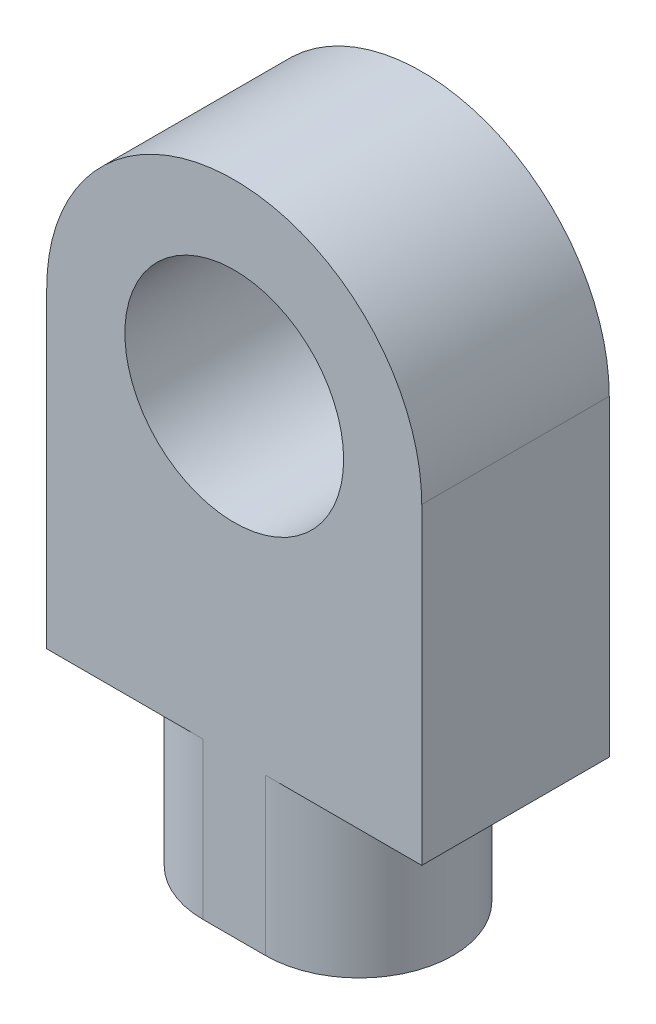
from build123d import *

# Parameters (mm, degrees)
BOSS_EXTRUDE1_DEPTH       = 6
M8X1_0_TAPPED_HOLE1_D     = 7
M8X1_0_TAPPED_HOLE1_DEPTH = 19
M8X1_0_TAPPED_HOLE1_TIP   = 2.103012167
CUT_EXTRUDE1_DEPTH        = 23.649503306
CUT_EXTRUDE1_DEPTH_BACK   = 5
SKETCH4_W                 = 9.430442817
SKETCH4_H                 = 6.865018404


with BuildPart() as part:
    # Sketch1 → Boss-Extrude1 (new body)
    with BuildSketch(Plane.XY):
        with BuildLine():
            Line((-4, -5), (4, -5))
            Line((4, -5), (4, 0))
            Line((4, 0), (6, 0))
            Line((6, 0), (6, 10))
            ThreePointArc((6, 10), (0, 16), (-6, 10))
            Line((-6, 10), (-6, 0))
            Line((-6, 0), (-4, 0))
            Line((-4, 0), (-4, -5))
        make_face()
    extrude(amount=BOSS_EXTRUDE1_DEPTH)

    # M8x1.0 Tapped Hole1
    with Locations(Plane.XY.offset(6)):
        with Locations((0, 10)):
            Hole(M8X1_0_TAPPED_HOLE1_D / 2, depth=M8X1_0_TAPPED_HOLE1_DEPTH)
            with Locations((0, 0, -(M8X1_0_TAPPED_HOLE1_DEPTH + M8X1_0_TAPPED_HOLE1_TIP / 2))):  # 118° drill point
                Cone(0, M8X1_0_TAPPED_HOLE1_D / 2, M8X1_0_TAPPED_HOLE1_TIP, mode=Mode.SUBTRACT)

    # Sketch4 → Cut-Extrude1 (cut, two sides: drawn at the far end of the back side and taken through both)
    with BuildSketch(Plane.XZ.offset(5).offset(-CUT_EXTRUDE1_DEPTH_BACK)):
        with Locations((0.112084889, 2.942713281)):
            Rectangle(SKETCH4_W, SKETCH4_H)
        with BuildLine():
            Line((-1, 6), (1, 6))
            ThreePointArc((1, 6), (4, 3), (1, 0))
            Line((1, 0), (-1, 0))
            ThreePointArc((-1, 0), (-4, 3), (-1, 6))
        make_face(mode=Mode.SUBTRACT)
    extrude(amount=CUT_EXTRUDE1_DEPTH + CUT_EXTRUDE1_DEPTH_BACK, mode=Mode.SUBTRACT)


solid = part.part
